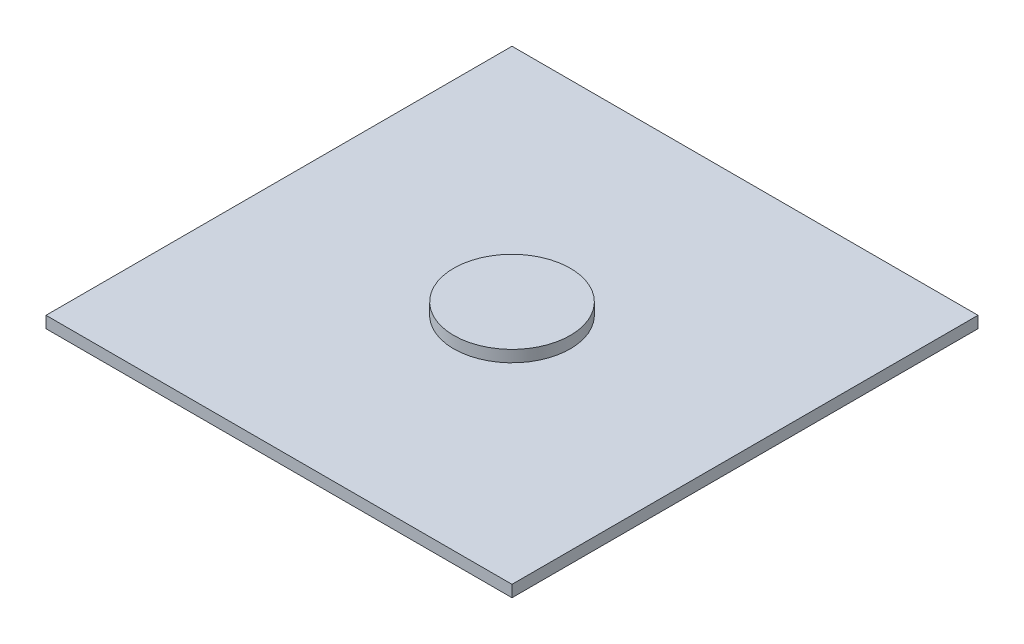
from build123d import *

# Parameters (mm, degrees)
SKETCH_1_W      = 40
SKETCH_1_H      = 40
EXTRUDE_1_DEPTH = 1
SKETCH_2_R      = 5
EXTRUDE_2_DEPTH = 1


with BuildPart() as part:
    # 草图1 → 凸台-拉伸1 (new body)
    with BuildSketch(Plane(origin=(0, 0, 0), x_dir=(1, 0, 0), z_dir=(0, 1, 0))):
        with Locations((20, 20)):
            Rectangle(SKETCH_1_W, SKETCH_1_H)
    extrude(amount=EXTRUDE_1_DEPTH)

    # 草图2 → 凸台-拉伸2 (add)
    with BuildSketch(Plane(origin=(0, 1, 0), x_dir=(1, 0, 0), z_dir=(0, 1, 0))):
        with Locations(Location((20, 20, 0), (0, 0, 270))):
            Circle(SKETCH_2_R)
    extrude(amount=EXTRUDE_2_DEPTH)


solid = part.part
